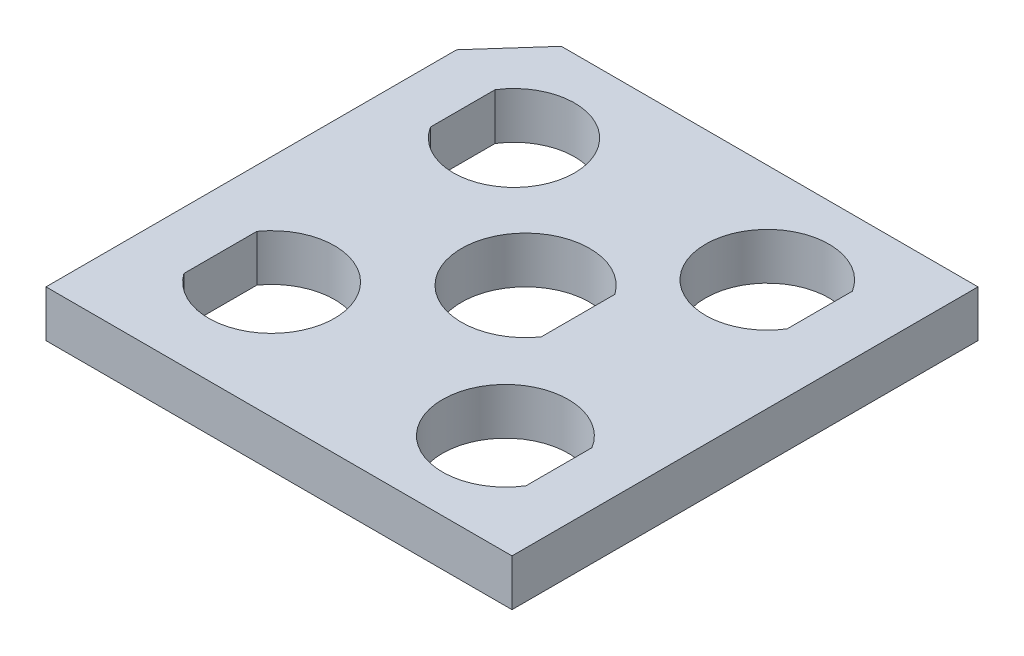
from build123d import *

# Parameters (mm, degrees)
ESBO_O1_W                = 20
ESBO_O1_H                = 20
RESSALTO_EXTRUS_O3_DEPTH = 2
CORTE_EXTRUS_O5_DEPTH    = 29.354893758


with BuildPart() as part:
    # Esboço1 → Ressalto-extrusão3 (new body)
    with BuildSketch(Plane(origin=(0, 0, 0), x_dir=(1, 0, 0), z_dir=(0, 1, 0))):
        with Locations((10, 10)):
            Rectangle(ESBO_O1_W, ESBO_O1_H)
    extrude(amount=RESSALTO_EXTRUS_O3_DEPTH)

    # Esboço5 → Corte-extrusão5 (cut, through all)
    with BuildSketch(Plane(origin=(0, 2, 0), x_dir=(1, 0, 0), z_dir=(0, 1, 0))):
        with BuildLine():
            Line((2.309294959, 16.962694399), (2.309294959, 14.191413107))
            ThreePointArc((2.309294959, 14.191413107), (7.109294959, 15.577053753), (2.309294959, 16.962694399))
        make_face()
        with BuildLine():
            Line((2.461667221, 3.455973937), (2.461667221, 6.586469106))
            ThreePointArc((2.461667221, 6.586469106), (7.361667221, 5.021221521), (2.461667221, 3.455973937))
        make_face()
        with BuildLine():
            Line((17.465138281, 14.341379407), (17.465138281, 17.141379407))
            ThreePointArc((17.465138281, 17.141379407), (12.565138281, 15.741379407), (17.465138281, 14.341379407))
        make_face()
        with BuildLine():
            Line((12.486102937, 11.927996301), (12.486102937, 8.765718641))
            ThreePointArc((12.486102937, 8.765718641), (7.486102937, 10.346857471), (12.486102937, 11.927996301))
        make_face()
        with BuildLine():
            Line((17.693873019, 5.738268613), (17.693873019, 2.909841488))
            ThreePointArc((17.693873019, 2.909841488), (12.693873019, 4.32405505), (17.693873019, 5.738268613))
        make_face()
        Polygon((3.125021592, 21.130122811), (-1.51392015, 15.923072084), (-4.183814677, 19.828549229), (-3.382846319, 21.73084908), align=None)
    extrude(amount=-CORTE_EXTRUS_O5_DEPTH, mode=Mode.SUBTRACT)


solid = part.part
